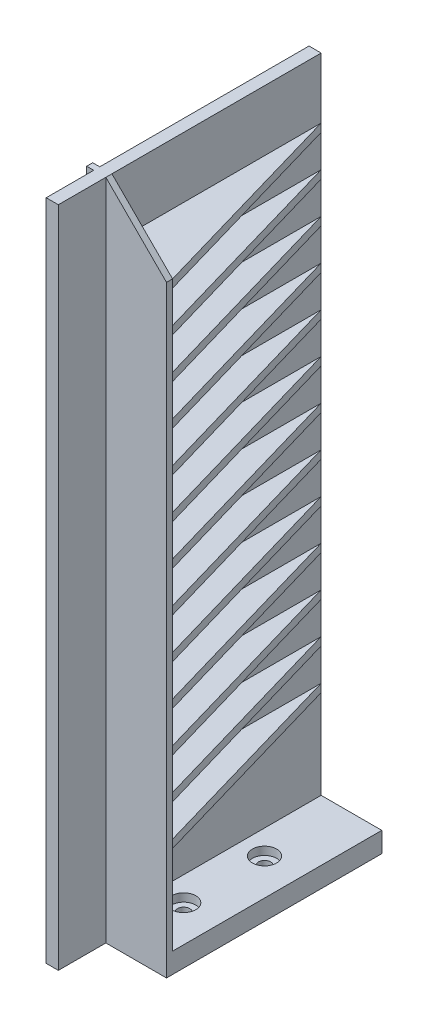
from build123d import *

# Parameters (mm, degrees)
EXTRUDE_1_DEPTH     = 164
SKETCH_3_R          = 1.5
CUT_EXTRUDE_1_DEPTH = 164
SKETCH_4_W          = 2
SKETCH_4_H          = 2
EXTRUDE_2_DEPTH     = 164
SKETCH_5_W          = 0.25
SKETCH_5_H          = 1.5
CUT_EXTRUDE_2_DEPTH = 164
SKETCH_6_W          = 15
SKETCH_6_H          = 50
CUT_EXTRUDE_3_DEPTH = 159
SKETCH_7_W          = 15
SKETCH_7_H          = 1.5
EXTRUDE_3_DEPTH     = 159
SKETCH_8_W          = 3.25
SKETCH_8_H          = 5
EXTRUDE_4_DEPTH     = 15
CUT_EXTRUDE_4_DEPTH = 15
SKETCH_10_R         = 3
CUT_EXTRUDE_5_DEPTH = 2
SKETCH_11_W         = 51.75
SKETCH_11_H         = 2
EXTRUDE_5_DEPTH     = 15
CUT_EXTRUDE_6_DEPTH = 130


with BuildPart() as part:
    # 草图1 → 凸台-拉伸1 (new body)
    with BuildSketch(Plane(origin=(0, 0, 0), x_dir=(1, 0, 0), z_dir=(0, 1, 0))):
        Polygon((0, 0), (0, -65), (3, -65), (3, -50), (18, -50), (18, 0), align=None)
    extrude(amount=EXTRUDE_1_DEPTH)

    # 草图3 → 切除-拉伸1 (cut)
    with BuildSketch(Plane(origin=(0, 164, 0), x_dir=(1, 0, 0), z_dir=(0, 1, 0))):
        with Locations(Location((9, -20, 0), (0, 0, 270))):
            Circle(SKETCH_3_R)
        with Locations(Location((9, -40, 0), (0, 0, 270))):
            Circle(SKETCH_3_R)
    extrude(amount=-CUT_EXTRUDE_1_DEPTH, mode=Mode.SUBTRACT)

    # 草图4 → 凸台-拉伸2 (add)
    with BuildSketch(Plane(origin=(0, 164, 0), x_dir=(1, 0, 0), z_dir=(0, 1, 0))):
        with Locations((-1, -52.5)):
            Rectangle(SKETCH_4_W, SKETCH_4_H)
    extrude(amount=-EXTRUDE_2_DEPTH)

    # 草图5 → 切除-拉伸2 (cut)
    with BuildSketch(Plane.XZ):
        Polygon((-1.75, 51.75), (-2, 51.75), (-2, 51.5), (0, 51.5), (0, 51.75), align=None)
        with Locations((-1.875, 52.5)):
            Rectangle(SKETCH_5_W, SKETCH_5_H)
        Polygon((-2, 53.5), (-2, 53.25), (-1.75, 53.25), (0, 53.25), (0, 53.5), align=None)
    extrude(amount=-CUT_EXTRUDE_2_DEPTH, mode=Mode.SUBTRACT)

    # 草图6 → 切除-拉伸3 (cut)
    with BuildSketch(Plane(origin=(0, 164, 0), x_dir=(1, 0, 0), z_dir=(0, 1, 0))):
        with Locations((10.5, -25)):
            Rectangle(SKETCH_6_W, SKETCH_6_H)
    extrude(amount=-CUT_EXTRUDE_3_DEPTH, mode=Mode.SUBTRACT)

    # 草图7 → 凸台-拉伸3 (add)
    with BuildSketch(Plane(origin=(0, 164, 0), x_dir=(1, 0, 0), z_dir=(0, 1, 0))):
        with Locations((10.5, -52.5)):
            Rectangle(SKETCH_7_W, SKETCH_7_H)
    extrude(amount=-EXTRUDE_3_DEPTH)

    # 草图8 → 凸台-拉伸4 (add)
    with BuildSketch(Plane(origin=(3, 0, 0), x_dir=(0, 0, -1), z_dir=(1, 0, 0))):
        with Locations((-51.625, 2.5)):
            Rectangle(SKETCH_8_W, SKETCH_8_H)
    extrude(amount=EXTRUDE_4_DEPTH)

    # 草图9 → 切除-拉伸4 (cut)
    with BuildSketch(Plane.XY.offset(53.25)):
        Polygon((3, 164), (18, 164), (18, 149), align=None)
    extrude(amount=-CUT_EXTRUDE_4_DEPTH, mode=Mode.SUBTRACT)

    # 草图10 → 切除-拉伸5 (cut)
    with BuildSketch(Plane(origin=(0, 5, 0), x_dir=(1, 0, 0), z_dir=(0, 1, 0))):
        with Locations(Location((9, -20, 0), (0, 0, 270))):
            Circle(SKETCH_10_R)
        with Locations(Location((9, -40, 0), (0, 0, 270))):
            Circle(SKETCH_10_R)
    extrude(amount=-CUT_EXTRUDE_5_DEPTH, mode=Mode.SUBTRACT)

    # 草图11 → 凸台-拉伸5 (add)
    with BuildSketch(Plane(origin=(3, 0, 0), x_dir=(0, 0, -1), z_dir=(1, 0, 0))):
        with Locations((-25.875, 148)):
            Rectangle(SKETCH_11_W, SKETCH_11_H)
        with Locations((-25.875, 138)):
            Rectangle(SKETCH_11_W, SKETCH_11_H)
        with Locations((-25.875, 128)):
            Rectangle(SKETCH_11_W, SKETCH_11_H)
        with Locations((-25.875, 118)):
            Rectangle(SKETCH_11_W, SKETCH_11_H)
        with Locations((-25.875, 108)):
            Rectangle(SKETCH_11_W, SKETCH_11_H)
        with Locations((-25.875, 98)):
            Rectangle(SKETCH_11_W, SKETCH_11_H)
        with Locations((-25.875, 88)):
            Rectangle(SKETCH_11_W, SKETCH_11_H)
        with Locations((-25.875, 78)):
            Rectangle(SKETCH_11_W, SKETCH_11_H)
        with Locations((-25.875, 68)):
            Rectangle(SKETCH_11_W, SKETCH_11_H)
        with Locations((-25.875, 58)):
            Rectangle(SKETCH_11_W, SKETCH_11_H)
        with Locations((-25.875, 48)):
            Rectangle(SKETCH_11_W, SKETCH_11_H)
        with Locations((-25.875, 38)):
            Rectangle(SKETCH_11_W, SKETCH_11_H)
        with Locations((-25.875, 28)):
            Rectangle(SKETCH_11_W, SKETCH_11_H)
    extrude(amount=EXTRUDE_5_DEPTH)

    # 草图12 → 切除-拉伸6 (cut)
    with BuildSketch(Plane(origin=(0, 149, 0), x_dir=(1, 0, 0), z_dir=(0, 1, 0))):
        Polygon((3, 0), (18, -51.75), (18, 0), align=None)
    extrude(amount=-CUT_EXTRUDE_6_DEPTH, mode=Mode.SUBTRACT)


solid = part.part
